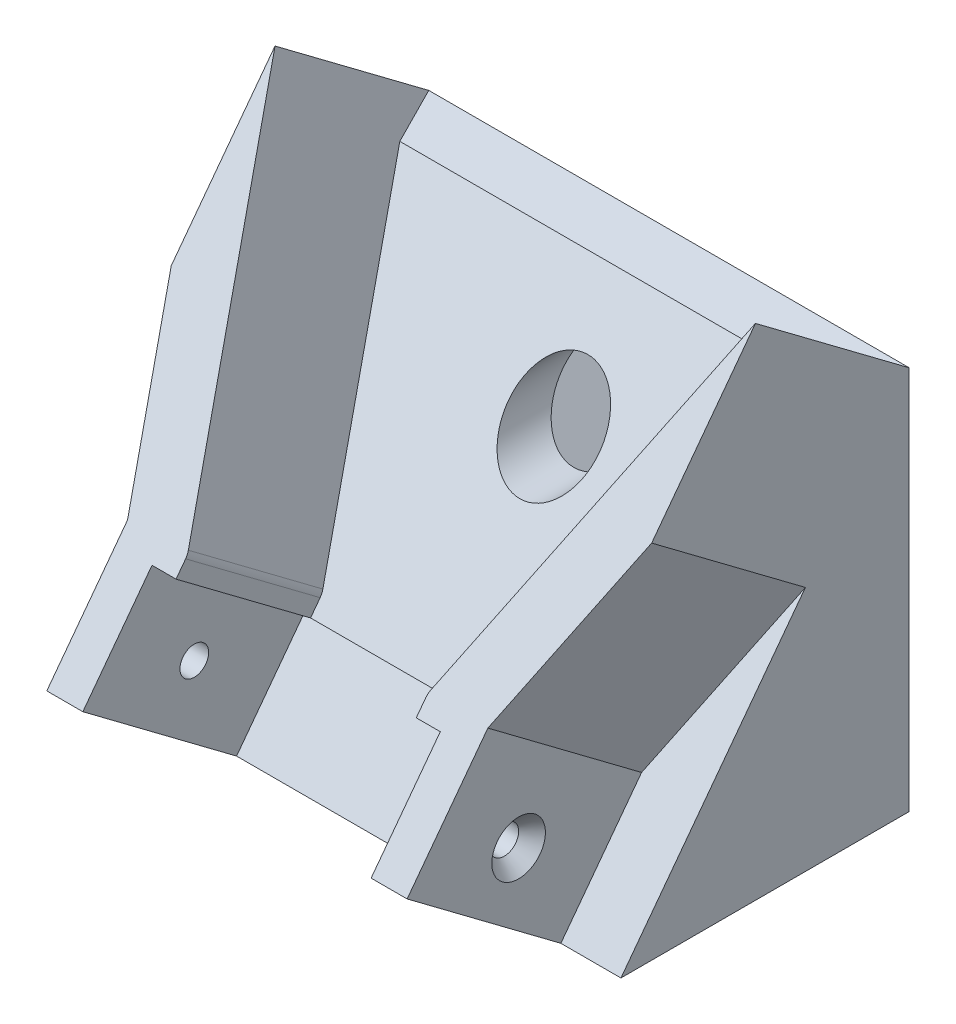
from build123d import *

# Parameters (mm, degrees)
BOSS_EXTRUDE2_DEPTH                            = 63.5
SHELL1_T                                       = -2.54
BOSS_EXTRUDE4_DEPTH                            = 25.4
FILLET1_R                                      = 2.54
CSK_FOR_6_FLAT_HEAD_MACHINE_SCREW2_D           = 3.7973
CSK_FOR_6_FLAT_HEAD_MACHINE_SCREW2_DEPTH       = 4.7625
CSK_FOR_6_FLAT_HEAD_MACHINE_SCREW2_CSINK_D     = 7.0866
CSK_FOR_6_FLAT_HEAD_MACHINE_SCREW2_CSINK_ANGLE = 82
CSK_FOR_6_FLAT_HEAD_MACHINE_SCREW1_D           = 3.7973
CSK_FOR_6_FLAT_HEAD_MACHINE_SCREW1_CSINK_D     = 7.0866
CSK_FOR_6_FLAT_HEAD_MACHINE_SCREW1_CSINK_ANGLE = 82
CUT_EXTRUDE1_REACH                             = 110.657
SKETCH10_R                                     = 3.5
BOSS_EXTRUDE6_START                            = 3.175
BOSS_EXTRUDE6_DEPTH                            = 3.175
SKETCH15_R                                     = 6
CUT_EXTRUDE2_DEPTH                             = 38.735


with BuildPart() as part:
    # Sketch4 → Boss-Extrude2 (new body)
    with BuildSketch(Plane(origin=(0, 0, 0), x_dir=(0, 0, -1), z_dir=(1, 0, 0))):
        Polygon((0, 50.8), (-38.100141797, 0), (0, 0), align=None)
    extrude(amount=BOSS_EXTRUDE2_DEPTH)

    # Shell1
    shell1_openings = [part.faces().sort_by_distance(p)[0] for p in [
        (31.75, 0, 19.050070899),
    ]]
    offset(amount=SHELL1_T, openings=shell1_openings, kind=Kind.INTERSECTION)

    # Sketch5 → Boss-Extrude4 (add)
    with BuildSketch(Plane(origin=(0, 18.28808712, 24.38402541), x_dir=(1, 0, 0), z_dir=(0, 0.6000014291326663, 0.7999989281485057))):
        Polygon((12.7, -22.860139528), (12.7, -7.620139528), (15.875, -7.620139528), (15.875, -5.080139528), (0, 40.63994555), (0, 17.779903011), (7.9375, -5.080139528), (7.9375, -22.860139528), align=None)
        Polygon((55.5625, -5.080139528), (55.5625, -22.860139528), (50.8, -22.860139528), (50.8, -7.620139528), (47.625, -7.620139528), (47.625, -5.080139528), (63.5, 40.63994555), (63.5, 17.779903011), align=None)
    extrude(amount=BOSS_EXTRUDE4_DEPTH)

    # Fillet1
    fillet1_edges = [part.edges().sort_by_distance(p)[0] for p in [
        (15.875, 21.843999092, 37.592102775),
        (47.625, 21.843999092, 37.592102775),
    ]]
    fillet(fillet1_edges, radius=FILLET1_R)

    # CSK for #6 Flat Head Machine Screw2
    with Locations(Plane.ZY.offset(-7.9375)):
        with Locations((43.688117295, 13.716009982)):
            CounterSinkHole(CSK_FOR_6_FLAT_HEAD_MACHINE_SCREW2_D / 2, CSK_FOR_6_FLAT_HEAD_MACHINE_SCREW2_CSINK_D / 2, depth=CSK_FOR_6_FLAT_HEAD_MACHINE_SCREW2_DEPTH, counter_sink_angle=CSK_FOR_6_FLAT_HEAD_MACHINE_SCREW2_CSINK_ANGLE)

    # CSK for #6 Flat Head Machine Screw1 (through all)
    with Locations(Plane(origin=(55.5625, 0, 0), x_dir=(0, 0, -1), z_dir=(1, 0, 0))):
        with Locations((-43.688117295, 13.716009982)):
            CounterSinkHole(CSK_FOR_6_FLAT_HEAD_MACHINE_SCREW1_D / 2, CSK_FOR_6_FLAT_HEAD_MACHINE_SCREW1_CSINK_D / 2, counter_sink_angle=CSK_FOR_6_FLAT_HEAD_MACHINE_SCREW1_CSINK_ANGLE)

    # Sketch10 → Cut-Extrude1 (cut, up to next)
    with BuildSketch(Plane(origin=(0, 0, 0), x_dir=(-1, 0, 0), z_dir=(0, 0, -1)), mode=Mode.PRIVATE) as cut_extrude1_sk1:
        with Locations((-31.75, 35.8)):
            Circle(SKETCH10_R)
    cut_extrude1_tool1 = extrude(cut_extrude1_sk1.sketch, amount=-CUT_EXTRUDE1_REACH, mode=Mode.PRIVATE) & part.part
    add(cut_extrude1_tool1.solids().sort_by_distance((31.75, 35.8, 0))[0], mode=Mode.SUBTRACT)

    # Sketch11 → Boss-Extrude6 (add)
    with BuildSketch(Plane(origin=(0, 18.28808712, 24.38402541), x_dir=(1, 0, 0), z_dir=(0, 0.6000014291326664, 0.7999989281485057)).offset(BOSS_EXTRUDE6_START)):
        with BuildLine():
            Line((1.763885607, 35.55994555), (61.736114393, 35.55994555))
            Line((61.736114393, 35.55994555), (47.765528412, -4.675416947))
            ThreePointArc((47.765528412, -4.675416947), (47.660378488, -5.086106873), (47.625, -5.508565254))
            Line((47.625, -5.508565254), (47.625, -7.620139528))
            Line((47.625, -7.620139528), (15.875, -7.620139528))
            Line((15.875, -7.620139528), (15.875, -5.508565254))
            ThreePointArc((15.875, -5.508565254), (15.839621512, -5.086106873), (15.734471588, -4.675416947))
            Line((15.734471588, -4.675416947), (1.763885607, 35.55994555))
        make_face()
    extrude(amount=-BOSS_EXTRUDE6_DEPTH)

    # Sketch14 → Loft2 section 0
    with BuildSketch(Plane(origin=(12.592837865, 3.497999322, -2.623509255), x_dir=(-0.16778323619732566, -0.12899238858965661, -0.9773483254894785), z_dir=(0.9446738533698645, 0.2624085638294688, -0.19680715532796914))):
        with BuildLine():
            Line((-6.55281334, 48.579854588), (-12.031696709, 45.583164002))
            Line((-12.031696709, 45.583164002), (-9.303504202, 43.959097917))
            Line((-9.303504202, 43.959097917), (-6.55281334, 48.579854588))
        make_face()
    # Sketch12 → Loft2 section 1
    with BuildSketch(Plane(origin=(44.075113902, -12.243048009, 9.182320181), x_dir=(-0.16312891841524135, 0.1446897924855975, 0.9759374057423705), z_dir=(-0.9446738533698645, 0.26240856382946876, -0.19680715532796894))):
        with BuildLine():
            Line((2.42045406, 63.449507231), (-3.008444861, 66.535827684))
            Line((-3.008444861, 66.535827684), (-0.334058341, 61.870492844))
            Line((-0.334058341, 61.870492844), (2.42045406, 63.449507231))
        make_face()
    loft()

    # Sketch15 → Cut-Extrude2 (cut)
    with BuildSketch(Plane.XY.offset(2.54)):
        with Locations(Location((31.75, 35.8, 0), (0, 0, 90))):
            Circle(SKETCH15_R)
    extrude(amount=CUT_EXTRUDE2_DEPTH, mode=Mode.SUBTRACT)


solid = part.part
